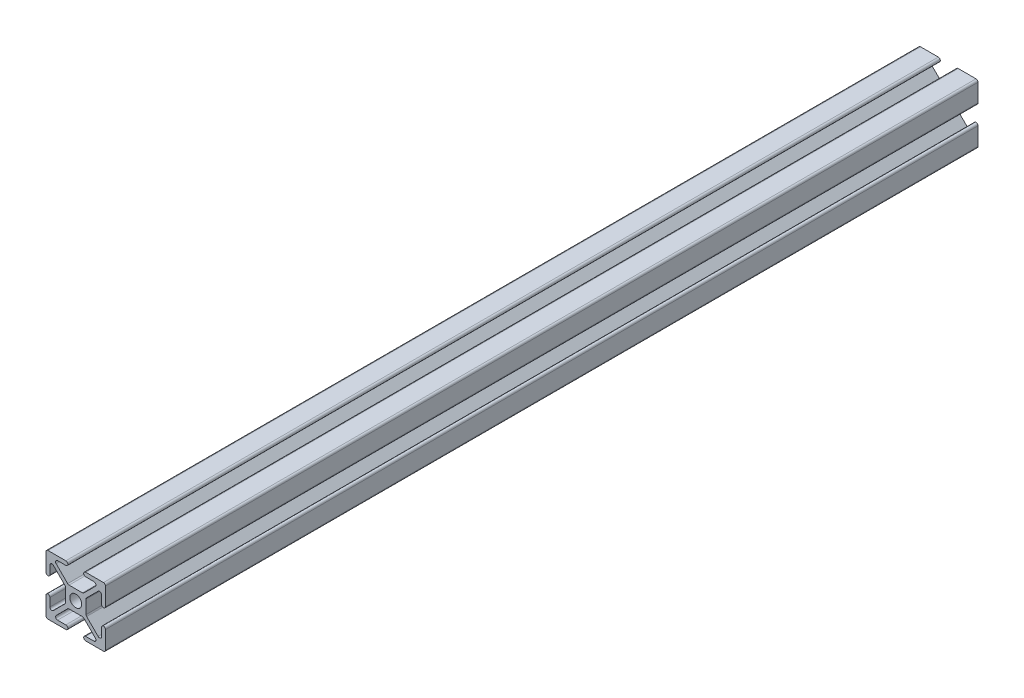
from build123d import *

# Parameters (mm, degrees)
SALIENTE_EXTRUIR1_DEPTH = 440
CROQUIS2_R              = 3
CORTAR_EXTRUIR1_DEPTH   = 441.51106683
CORTAR_EXTRUIR3_DEPTH   = 441.51106683


with BuildPart() as part:
    # Croquis1 → Saliente-Extruir1 (new body)
    with BuildSketch(Plane.XY):
        with BuildLine():
            Line((-14, 15), (14, 15))
            ThreePointArc((14, 15), (14.707106781, 14.707106781), (15, 14))
            Line((15, 14), (15, -14))
            ThreePointArc((15, -14), (14.707106781, -14.707106781), (14, -15))
            Line((14, -15), (-14, -15))
            ThreePointArc((-14, -15), (-14.707106781, -14.707106781), (-15, -14))
            Line((-15, -14), (-15, 14))
            ThreePointArc((-15, 14), (-14.707106781, 14.707106781), (-14, 15))
        make_face()
    extrude(amount=-SALIENTE_EXTRUIR1_DEPTH)

    # Croquis2 → Cortar-Extruir1 (cut, through all)
    with BuildSketch(Plane.XY):
        Circle(CROQUIS2_R)
    extrude(amount=-CORTAR_EXTRUIR1_DEPTH, mode=Mode.SUBTRACT)

    # Croquis3 → Cortar-Extruir3 (cut, through all)
    with BuildSketch(Plane.XY):
        with BuildLine():
            Line((-5.492893219, 4.078679656), (-11.292893219, 9.878679656))
            ThreePointArc((-11.292893219, 9.878679656), (-12.382683432, 10.095452408), (-13, 9.171572875))
            Line((-13, 9.171572875), (-13, 5))
            ThreePointArc((-13, 5), (-14, 4), (-15, 5))
            Line((-15, 5), (-15, -5))
            ThreePointArc((-15, -5), (-14, -4), (-13, -5))
            Line((-13, -5), (-13, -9.171572875))
            ThreePointArc((-13, -9.171572875), (-12.382683432, -10.095452408), (-11.292893219, -9.878679656))
            Line((-11.292893219, -9.878679656), (-5.492893219, -4.078679656))
            ThreePointArc((-5.492893219, -4.078679656), (-5.276120467, -3.754256308), (-5.2, -3.371572875))
            Line((-5.2, -3.371572875), (-5.2, 3.371572875))
            ThreePointArc((-5.2, 3.371572875), (-5.276120467, 3.754256308), (-5.492893219, 4.078679656))
        make_face()
        with BuildLine():
            ThreePointArc((-9.171572875, 13), (-10.095452408, 12.382683432), (-9.878679656, 11.292893219))
            Line((-9.878679656, 11.292893219), (-4.078679656, 5.492893219))
            ThreePointArc((-4.078679656, 5.492893219), (-3.754256308, 5.276120467), (-3.371572875, 5.2))
            Line((-3.371572875, 5.2), (3.371572875, 5.2))
            ThreePointArc((3.371572875, 5.2), (3.754256308, 5.276120467), (4.078679656, 5.492893219))
            Line((4.078679656, 5.492893219), (9.878679656, 11.292893219))
            ThreePointArc((9.878679656, 11.292893219), (10.095452408, 12.382683432), (9.171572875, 13))
            Line((9.171572875, 13), (5, 13))
            ThreePointArc((5, 13), (4, 14), (5, 15))
            Line((5, 15), (-5, 15))
            ThreePointArc((-5, 15), (-4.292893219, 14.707106781), (-4, 14))
            ThreePointArc((-4, 14), (-4.292893219, 13.292893219), (-5, 13))
            Line((-5, 13), (-9.171572875, 13))
        make_face()
        with BuildLine():
            Line((9.878679656, -11.292893219), (4.078679656, -5.492893219))
            ThreePointArc((4.078679656, -5.492893219), (3.754256308, -5.276120467), (3.371572875, -5.2))
            Line((3.371572875, -5.2), (-3.371572875, -5.2))
            ThreePointArc((-3.371572875, -5.2), (-3.754256308, -5.276120467), (-4.078679656, -5.492893219))
            Line((-4.078679656, -5.492893219), (-9.878679656, -11.292893219))
            ThreePointArc((-9.878679656, -11.292893219), (-10.095452408, -12.382683432), (-9.171572875, -13))
            Line((-9.171572875, -13), (-5, -13))
            ThreePointArc((-5, -13), (-4.292893219, -13.292893219), (-4, -14))
            ThreePointArc((-4, -14), (-4.292893219, -14.707106781), (-5, -15))
            Line((-5, -15), (5, -15))
            ThreePointArc((5, -15), (4, -14), (5, -13))
            Line((5, -13), (9.171572875, -13))
            ThreePointArc((9.171572875, -13), (10.095452408, -12.382683432), (9.878679656, -11.292893219))
        make_face()
        with BuildLine():
            ThreePointArc((13, 9.171572875), (12.382683432, 10.095452408), (11.292893219, 9.878679656))
            Line((11.292893219, 9.878679656), (5.492893219, 4.078679656))
            ThreePointArc((5.492893219, 4.078679656), (5.276120467, 3.754256308), (5.2, 3.371572875))
            Line((5.2, 3.371572875), (5.2, -3.371572875))
            ThreePointArc((5.2, -3.371572875), (5.276120467, -3.754256308), (5.492893219, -4.078679656))
            Line((5.492893219, -4.078679656), (11.292893219, -9.878679656))
            ThreePointArc((11.292893219, -9.878679656), (12.382683432, -10.095452408), (13, -9.171572875))
            Line((13, -9.171572875), (13, -5))
            ThreePointArc((13, -5), (14, -4), (15, -5))
            Line((15, -5), (15, 5))
            ThreePointArc((15, 5), (14, 4), (13, 5))
            Line((13, 5), (13, 9.171572875))
        make_face()
    extrude(amount=-CORTAR_EXTRUIR3_DEPTH, mode=Mode.SUBTRACT)


solid = part.part
